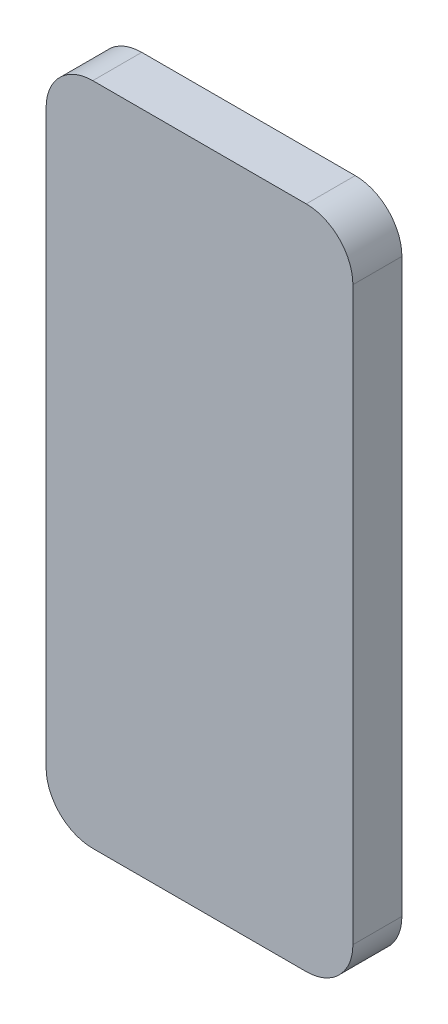
from build123d import *

# Parameters (mm, degrees)
SKETCH_1_W      = 39.45
SKETCH_1_H      = 85.5
EXTRUDE_1_DEPTH = 6.3
FILLET_1_R      = 6
SKETCH_2_R      = 4.25
EXTRUDE_2_DEPTH = 0.5


with BuildPart() as part:
    # 스케치1 → 보스-돌출1 (new body)
    with BuildSketch(Plane.XY):
        Rectangle(SKETCH_1_W, SKETCH_1_H)
    extrude(amount=EXTRUDE_1_DEPTH)

    # 필렛1
    fillet_1_edges = [part.edges().sort_by_distance(p)[0] for p in [
        (19.725, -42.75, 3.15),
        (-19.725, -42.75, 3.15),
        (-19.725, 42.75, 3.15),
        (19.725, 42.75, 3.15),
    ]]
    fillet(fillet_1_edges, radius=FILLET_1_R)

    # 스케치2 → 보스-돌출2 (add)
    with BuildSketch(Plane(origin=(0, 0, 0), x_dir=(-1, 0, 0), z_dir=(0, 0, -1))):
        with Locations(Location((-11.225, 32.25, 0), (0, 0, 180))):
            Circle(SKETCH_2_R)
        with Locations(Location((11.225, 32.25, 0), (0, 0, 180))):
            Circle(SKETCH_2_R)
        with Locations(Location((0, 32.25, 0), (0, 0, 180))):
            Circle(SKETCH_2_R)
        with Locations(Location((-11.225, 22.25, 0), (0, 0, 180))):
            Circle(SKETCH_2_R)
        with Locations(Location((0, 22.25, 0), (0, 0, 180))):
            Circle(SKETCH_2_R)
        with Locations(Location((11.225, 22.25, 0), (0, 0, 180))):
            Circle(SKETCH_2_R)
        with Locations(Location((-11.225, 12.25, 0), (0, 0, 180))):
            Circle(SKETCH_2_R)
        with Locations(Location((0, 12.25, 0), (0, 0, 180))):
            Circle(SKETCH_2_R)
        with Locations(Location((11.225, 12.25, 0), (0, 0, 180))):
            Circle(SKETCH_2_R)
        with Locations(Location((-11.225, 2.25, 0), (0, 0, 180))):
            Circle(SKETCH_2_R)
        with Locations(Location((0, 2.25, 0), (0, 0, 180))):
            Circle(SKETCH_2_R)
        with Locations(Location((11.225, 2.25, 0), (0, 0, 180))):
            Circle(SKETCH_2_R)
        with Locations(Location((-11.225, -7.75, 0), (0, 0, 180))):
            Circle(SKETCH_2_R)
        with Locations(Location((0, -7.75, 0), (0, 0, 180))):
            Circle(SKETCH_2_R)
        with Locations(Location((11.225, -7.75, 0), (0, 0, 180))):
            Circle(SKETCH_2_R)
        with Locations(Location((-11.225, -17.75, 0), (0, 0, 180))):
            Circle(SKETCH_2_R)
        with Locations(Location((0, -17.75, 0), (0, 0, 180))):
            Circle(SKETCH_2_R)
        with Locations(Location((11.225, -17.75, 0), (0, 0, 180))):
            Circle(SKETCH_2_R)
        with Locations(Location((-11.225, -27.75, 0), (0, 0, 180))):
            Circle(SKETCH_2_R)
        with Locations(Location((0, -27.75, 0), (0, 0, 180))):
            Circle(SKETCH_2_R)
        with Locations(Location((11.225, -27.75, 0), (0, 0, 180))):
            Circle(SKETCH_2_R)
    extrude(amount=EXTRUDE_2_DEPTH)


solid = part.part
